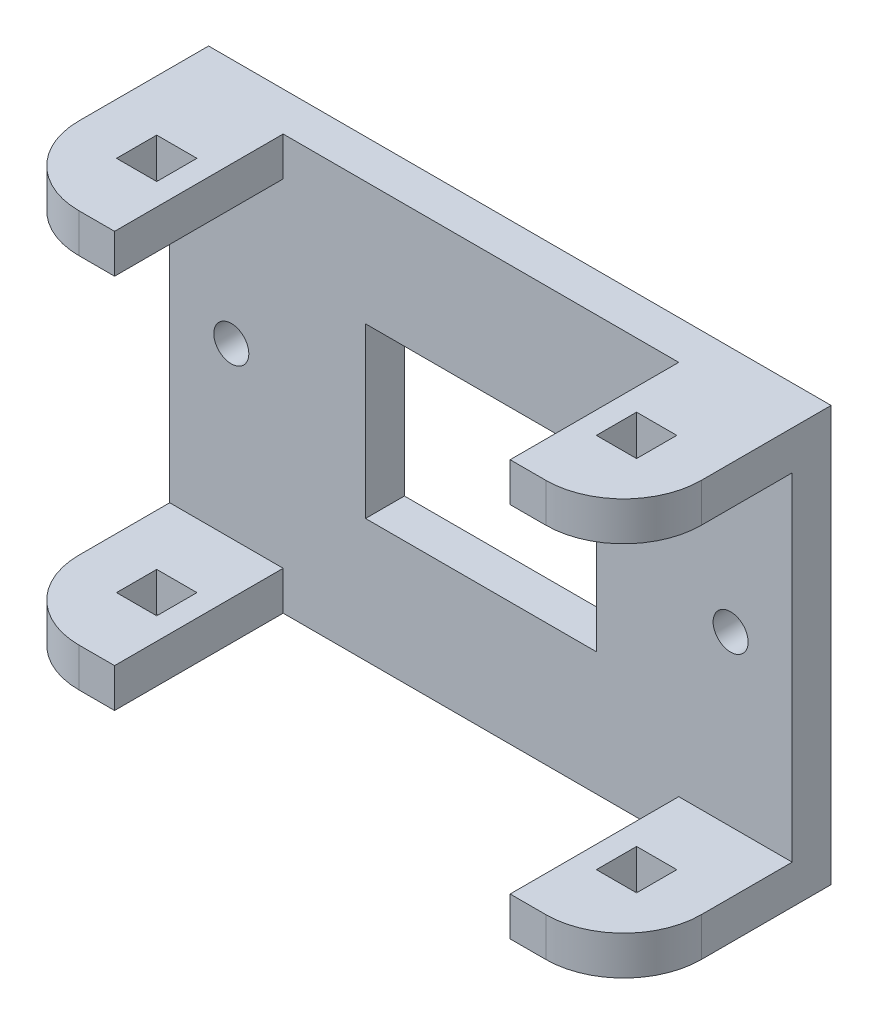
from build123d import *

# Parameters (mm, degrees)
ESBO_O6_W                  = 48
ESBO_O6_H                  = 32
ESBO_O6_W_2                = 17.8
ESBO_O6_H_2                = 13
RESSALTO_EXTRUS_O2_DEPTH   = 3
ESBO_O7_R                  = 1.35
CORTE_EXTRUS_O3_DEPTH      = 30
ESBO_O8_W                  = 48
ESBO_O8_H                  = 3
RESSALTO_EXTRUS_O3_DEPTH   = 13
CORTE_EXTRUS_O4_DEPTH      = 41.902322672
CORTE_EXTRUS_O4_DEPTH_BACK = 41.902322672
ESBO_O10_W                 = 3.1
ESBO_O10_H                 = 3.1
CORTE_EXTRUS_O5_DEPTH      = 41.902322672
CORTE_EXTRUS_O5_DEPTH_BACK = 41.902322672
ESBO_O11_W                 = 30.5
ESBO_O11_H                 = 13
FILETE1_R                  = 6
FILETE2_R                  = 6
FILETE3_R                  = 6


with BuildPart() as part:
    # Esboço6 → Ressalto-extrusão2 (new body)
    with BuildSketch(Plane.XY):
        Rectangle(ESBO_O6_W, ESBO_O6_H)
        Rectangle(ESBO_O6_W_2, ESBO_O6_H_2, mode=Mode.SUBTRACT)
    extrude(amount=RESSALTO_EXTRUS_O2_DEPTH)

    # Esboço7 → Corte-extrusão3 (cut, through all)
    with BuildSketch(Plane.XY.offset(3)):
        with Locations((-19.25, 0)):
            Circle(ESBO_O7_R)
        with Locations(Location((19.25, 0, 0), (0, 0, 180))):
            Circle(ESBO_O7_R)
    extrude(amount=-CORTE_EXTRUS_O3_DEPTH, mode=Mode.SUBTRACT)

    # Esboço8 → Ressalto-extrusão3 (add)
    with BuildSketch(Plane.XY.offset(3)):
        with Locations((0, -14.5)):
            Rectangle(ESBO_O8_W, ESBO_O8_H)
        with Locations((0, 14.5)):
            Rectangle(ESBO_O8_W, ESBO_O8_H)
    extrude(amount=RESSALTO_EXTRUS_O3_DEPTH)

    # Esboço10 → Corte-extrusão4 (cut, two sides: drawn at the far end of the back side and taken through both)
    with BuildSketch(Plane.XZ.offset(-13).offset(-CORTE_EXTRUS_O4_DEPTH_BACK)):
        with Locations((18.5, 9.5)):
            Rectangle(ESBO_O10_W, ESBO_O10_H)
        with Locations((-18.5, 9.5)):
            Rectangle(ESBO_O10_W, ESBO_O10_H)
    extrude(amount=CORTE_EXTRUS_O4_DEPTH + CORTE_EXTRUS_O4_DEPTH_BACK, mode=Mode.SUBTRACT)

    # Esboço11 → Corte-extrusão5 (cut, two sides: drawn at the far end of the back side and taken through both)
    with BuildSketch(Plane.XZ.offset(-13).offset(-CORTE_EXTRUS_O5_DEPTH_BACK)):
        with Locations((0, 9.5)):
            Rectangle(ESBO_O11_W, ESBO_O11_H)
    extrude(amount=CORTE_EXTRUS_O5_DEPTH + CORTE_EXTRUS_O5_DEPTH_BACK, mode=Mode.SUBTRACT)

    # Filete1
    filete1_edges = [part.edges().sort_by_distance(p)[0] for p in [
        (24, -14.5, 16),
    ]]
    fillet(filete1_edges, radius=FILETE1_R)

    # Filete2
    filete2_edges = [part.edges().sort_by_distance(p)[0] for p in [
        (24, 14.5, 16),
    ]]
    fillet(filete2_edges, radius=FILETE2_R)

    # Filete3
    filete3_edges = [part.edges().sort_by_distance(p)[0] for p in [
        (-24, 14.5, 16),
        (-24, -14.5, 16),
    ]]
    fillet(filete3_edges, radius=FILETE3_R)


solid = part.part
